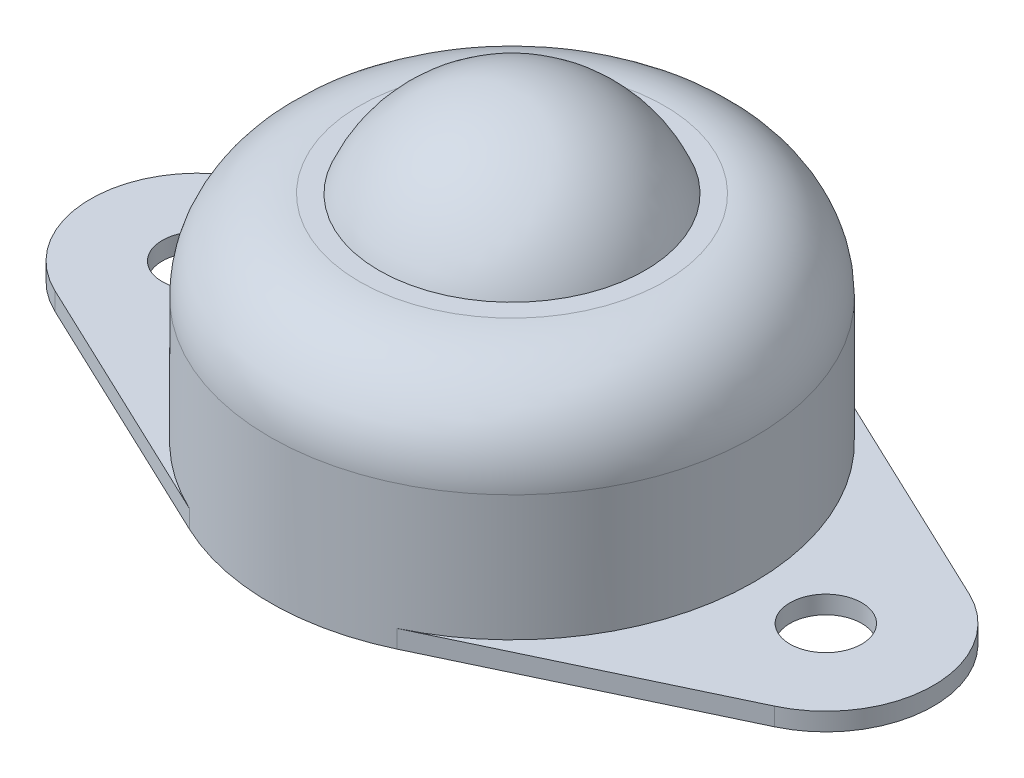
from build123d import *
from build123d.topology import SkipClean

# Parameters (mm, degrees)
EXTRUDE_1_DEPTH     = 1
SKETCH_2_R          = 13.5
EXTRUDE_2_DEPTH     = 12
FILLET_1_R          = 5
SKETCH_5_R          = 2
CUT_EXTRUDE_1_DEPTH = 33.53459697


with BuildPart() as part:
    # 草图1 → 凸台-拉伸1 (new body)
    with BuildSketch(Plane(origin=(0, 0, 0), x_dir=(1, 0, 0), z_dir=(0, 1, 0))):
        with BuildLine():
            Line((-20.071428571, 5.421047417), (-5.785714286, 12.197356689))
            ThreePointArc((-5.785714286, 12.197356689), (0, 13.5), (5.785714286, 12.197356689))
            Line((5.785714286, 12.197356689), (20.071428571, 5.421047417))
            ThreePointArc((20.071428571, 5.421047417), (23.5, 0), (20.071428571, -5.421047417))
            Line((20.071428571, -5.421047417), (5.785714286, -12.197356689))
            ThreePointArc((5.785714286, -12.197356689), (0, -13.5), (-5.785714286, -12.197356689))
            Line((-5.785714286, -12.197356689), (-20.071428571, -5.421047417))
            ThreePointArc((-20.071428571, -5.421047417), (-23.5, 0), (-20.071428571, 5.421047417))
        make_face()
    extrude(amount=EXTRUDE_1_DEPTH)

    # 草图2 → 凸台-拉伸2 (add)
    with SkipClean():  # the faces are left unmerged after this step: merging them gives an invalid solid
        with BuildSketch(Plane(origin=(0, 1, 0), x_dir=(1, 0, 0), z_dir=(0, 1, 0))):
            with Locations(Location((0, 0, 0), (0, 0, 115.376933525))):
                Circle(SKETCH_2_R)
        extrude(amount=EXTRUDE_2_DEPTH)

    # 草图4 → 旋转1 (revolve)
    with SkipClean():  # the faces are left unmerged after this step: merging them gives an invalid solid
        with BuildSketch(Plane(origin=(0, 0, 0), x_dir=(0, 0, -1), z_dir=(1, 0, 0))):
            with BuildLine():
                Line((0, 18), (0, 2))
                ThreePointArc((0, 2), (-8, 10), (0, 18))
            make_face()
        revolve(axis=Axis((0, 18, 0), (0, -1, 0)))

    # 圆角1
    fillet_1_edges = [part.edges().sort_by_distance(p)[0] for p in [
        (5.785714286, 13, 12.197356689),
    ]]
    fillet(fillet_1_edges, radius=FILLET_1_R)

    # 草图5 → 切除-拉伸1 (cut, through all)
    with SkipClean():  # the faces are left unmerged after this step: merging them gives an invalid solid
        with BuildSketch(Plane.XZ):
            with Locations(Location((-17.5, 0, 0), (0, 0, 270))):
                Circle(SKETCH_5_R)
            with Locations(Location((17.5, 0, 0), (0, 0, 270))):
                Circle(SKETCH_5_R)
        extrude(amount=-CUT_EXTRUDE_1_DEPTH, mode=Mode.SUBTRACT)


solid = part.part
